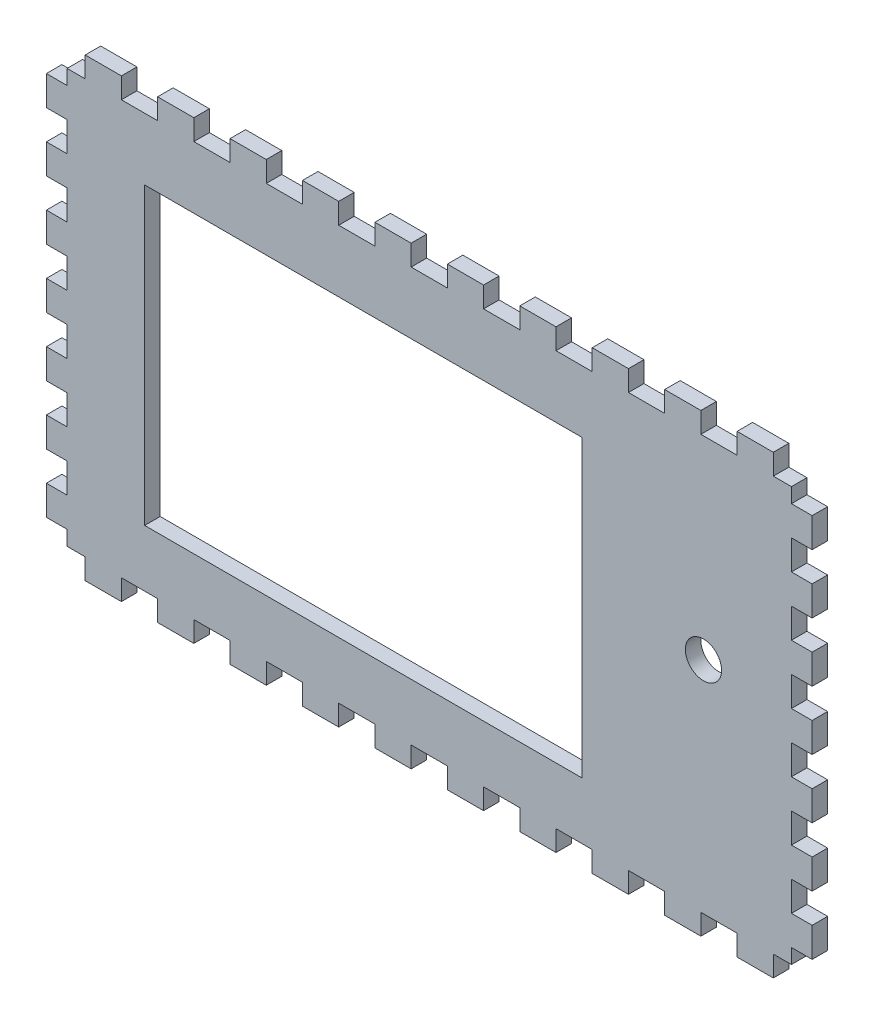
from build123d import *

# Parameters (mm, degrees)
SCHIZZO1_W                   = 140
SCHIZZO1_H                   = 80
SCHIZZO1_R                   = 3.5
SCHIZZO1_W_2                 = 95
SCHIZZO1_H_2                 = 61
ESTRUSIONE_ESTRUSIONE1_DEPTH = 3
SCHIZZO2_W                   = 7
SCHIZZO2_H                   = 4
ESTRUSIONE_ESTRUSIONE2_DEPTH = 3
RIPETIZIONE_A_L1_COUNT       = 10
RIPETIZIONE_A_L1_PITCH       = 14
SCHIZZO3_W                   = 4
SCHIZZO3_H                   = 5.714285714
ESTRUSIONE_ESTRUSIONE3_DEPTH = 3
RIPETIZIONE_A_L2_COUNT       = 7
RIPETIZIONE_A_L2_PITCH       = 11.428571429
SCHIZZO4_W                   = 95
SCHIZZO4_H                   = 61
SCHIZZO4_W_2                 = 84.5
SCHIZZO4_H_2                 = 57
ESTRUSIONE_ESTRUSIONE4_DEPTH = 3


with BuildPart() as part:
    # Schizzo1 → Estrusione-Estrusione1 (new body)
    with BuildSketch(Plane.XY):
        with Locations((70, 40)):
            Rectangle(SCHIZZO1_W, SCHIZZO1_H)
        with Locations((123, 42.5)):
            Circle(SCHIZZO1_R, mode=Mode.SUBTRACT)
        with Locations((59.5, 39.5)):
            Rectangle(SCHIZZO1_W_2, SCHIZZO1_H_2, mode=Mode.SUBTRACT)
    extrude(amount=ESTRUSIONE_ESTRUSIONE1_DEPTH)

    # Schizzo2 → Estrusione-Estrusione2 (add)
    with BuildSketch(Plane.XY.offset(3)):
        with Locations((7, 82)):
            Rectangle(SCHIZZO2_W, SCHIZZO2_H)
        with Locations((7, -2)):
            Rectangle(SCHIZZO2_W, SCHIZZO2_H)
    estrusione_estrusione2 = extrude(amount=-ESTRUSIONE_ESTRUSIONE2_DEPTH)

    # Ripetizione a L1: Estrusione-Estrusione2 ×10
    with Locations(*[(i * RIPETIZIONE_A_L1_PITCH, 0, 0) for i in range(1, RIPETIZIONE_A_L1_COUNT)]):
        add(estrusione_estrusione2)

    # Schizzo3 → Estrusione-Estrusione3 (add)
    with BuildSketch(Plane.XY.offset(3)):
        with Locations((-2, 74.285714286)):
            Rectangle(SCHIZZO3_W, SCHIZZO3_H)
        with Locations((142, 74.285714286)):
            Rectangle(SCHIZZO3_W, SCHIZZO3_H)
    estrusione_estrusione3 = extrude(amount=-ESTRUSIONE_ESTRUSIONE3_DEPTH)

    # Ripetizione a L2: Estrusione-Estrusione3 ×7
    with Locations(*[(0, -i * RIPETIZIONE_A_L2_PITCH, 0) for i in range(1, RIPETIZIONE_A_L2_COUNT)]):
        add(estrusione_estrusione3)

    # Schizzo4 → Estrusione-Estrusione4 (add)
    with BuildSketch(Plane.XY.offset(3)):
        with Locations((59.5, 39.5)):
            Rectangle(SCHIZZO4_W, SCHIZZO4_H)
        with Locations((57.25, 39.5)):
            Rectangle(SCHIZZO4_W_2, SCHIZZO4_H_2, mode=Mode.SUBTRACT)
    extrude(amount=-ESTRUSIONE_ESTRUSIONE4_DEPTH)


solid = part.part
